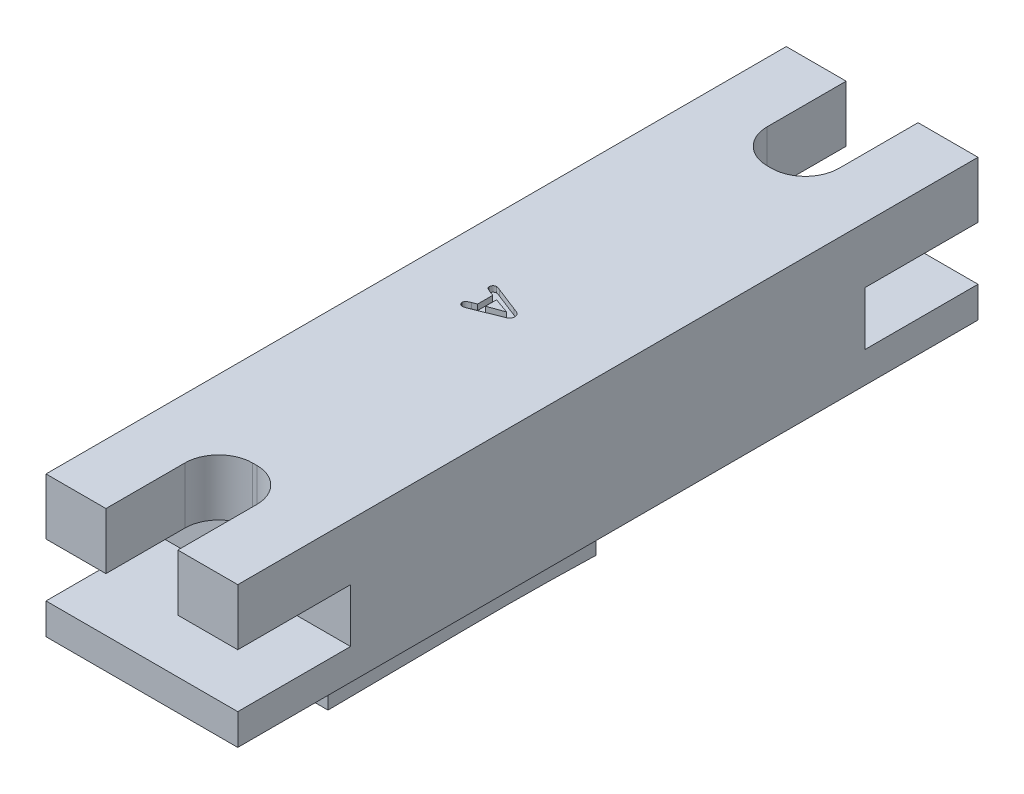
from build123d import *

# Parameters (mm, degrees)
SKETCH2_W            = 17.272
SKETCH2_H            = 66.675
BOSS_EXTRUDE1_DEPTH  = 12.7
SKETCH3_W            = 5.08
SKETCH3_H            = 6.35
SKETCH3_H_2          = 1.905
SKETCH3_H_3          = 1.27
BOSS_EXTRUDE2_DEPTH  = 12.7
CUT_EXTRUDE1_DEPTH   = 10.16
FILLET2_R            = 3.048
FILLET2_OF_MIRROR1_R = 3.048
CUT_EXTRUDE4_DEPTH   = 70.454139178
CUT_EXTRUDE5_DEPTH   = 0.508
CUT_EXTRUDE6_DEPTH   = 70.454139314


with BuildPart() as part:
    # Sketch2 → Boss-Extrude1 (new body)
    with BuildSketch(Plane(origin=(0, 0, 0), x_dir=(1, 0, 0), z_dir=(0, 1, 0))):
        with Locations((8.636, 33.3375)):
            Rectangle(SKETCH2_W, SKETCH2_H)
    extrude(amount=BOSS_EXTRUDE1_DEPTH)

    # Sketch3 → Boss-Extrude2 (add)
    with BuildSketch(Plane.XZ):
        with Locations((5.08, -29.21)):
            Rectangle(SKETCH3_W, SKETCH3_H)
        with Locations((5.08, -20.955)):
            Rectangle(SKETCH3_W, SKETCH3_H)
        with Locations((5.08, -25.0825)):
            Rectangle(SKETCH3_W, SKETCH3_H_2)
        with Locations((5.08, -33.3375)):
            Rectangle(SKETCH3_W, SKETCH3_H_2)
        with Locations((5.08, -37.465)):
            Rectangle(SKETCH3_W, SKETCH3_H)
        with Locations((5.08, -41.275)):
            Rectangle(SKETCH3_W, SKETCH3_H_3)
    extrude(amount=BOSS_EXTRUDE2_DEPTH)

    # Sketch4 → Cut-Extrude1 (cut)
    with BuildSketch(Plane.XY):
        Polygon((0, 7.62), (5.3975, 7.62), (5.3975, 12.7), (11.8745, 12.7), (11.8745, 7.62), (17.272, 7.62), (17.272, 2.794), (0, 2.794), align=None)
    cut_extrude1 = extrude(amount=-CUT_EXTRUDE1_DEPTH, mode=Mode.SUBTRACT)

    # Fillet2
    fillet2_edges = [part.edges().sort_by_distance(p)[0] for p in [
        (5.3975, 10.16, -10.16),
        (11.8745, 10.16, -10.16),
    ]]
    fillet(fillet2_edges, radius=FILLET2_R)

    # Mirror1: Cut-Extrude1 across plane
    add(cut_extrude1.mirror(Plane.XY.offset(-33.3375)), mode=Mode.SUBTRACT)

    # Fillet2 of Mirror1
    fillet2_of_mirror1_edges = [part.edges().sort_by_distance(p)[0] for p in [
        (5.3975, 10.16, -56.515),
        (11.8745, 10.16, -56.515),
    ]]
    fillet(fillet2_of_mirror1_edges, radius=FILLET2_OF_MIRROR1_R)

    # Sketch5 → Cut-Extrude4 (cut, through all)
    with BuildSketch(Plane.ZY.offset(-2.54)):
        with BuildLine():
            Line((-66.675, -12.7), (0, -12.7))
            ThreePointArc((0, -12.7), (-33.3375, -10.668), (-66.675, -12.7))
        make_face()
    extrude(amount=-CUT_EXTRUDE4_DEPTH, mode=Mode.SUBTRACT)

    # Sketch6 → Cut-Extrude5 (cut)
    with BuildSketch(Plane(origin=(0, 12.7, 0), x_dir=(1, 0, 0), z_dir=(0, 1, 0))):
        with BuildLine():
            Line((5.776894531, 32.530175781), (6.185, 32.690136719))
            Line((6.185, 32.690136719), (6.185, 34.051171875))
            Line((6.185, 34.051171875), (5.768007812, 34.211132812))
            add(Edge.make_bspline(
                [(5.768007812, 34.211132812), (5.730494518, 34.225820978), (5.661738716, 34.25274201), (5.569524922, 34.294468396), (5.496856289, 34.332290336), (5.44041907, 34.367362499), (5.398808713, 34.408271263), (5.372150366, 34.459568119), (5.356449781, 34.520790431), (5.354690345, 34.564901212), (5.35375, 34.588476562)],
                knots=[0, 0, 0, 0, 1.589179946, 2.912709847, 3.990397165, 4.820646782, 5.526248733, 6.26234321, 7.071295771, 8, 8, 8, 8], degree=3))
            add(Edge.make_bspline(
                [(5.35375, 34.588476562), (5.354923711, 34.609350692), (5.35723832, 34.650515396), (5.376105038, 34.709983847), (5.405904793, 34.765474392), (5.446909477, 34.815335315), (5.494806824, 34.85769508), (5.547709989, 34.88945387), (5.604426015, 34.909062179), (5.643671152, 34.911349233), (5.663417969, 34.9125)],
                knots=[0, 0, 0, 0, 1.012851797, 1.997388367, 3.003373292, 4.058581268, 5.118255936, 6.09654221, 7.042244815, 8, 8, 8, 8], degree=3))
            add(Edge.make_bspline(
                [(5.663417969, 34.9125), (5.687013914, 34.911555345), (5.735537805, 34.90961271), (5.796155547, 34.892709958), (5.849374825, 34.875661052), (5.897051464, 34.858225338), (5.952411749, 34.838064341), (5.991361751, 34.822388839), (6.012050781, 34.8140625)],
                knots=[0, 0, 0, 0, 1.162954171, 2.391557502, 3.08930458, 3.926034863, 4.898374222, 6, 6, 6, 6], degree=3))
            Line((6.012050781, 34.8140625), (8.209804687, 33.957519531))
            add(Edge.make_bspline(
                [(8.209804687, 33.957519531), (8.226428771, 33.951113113), (8.261020453, 33.937782526), (8.315677882, 33.917334175), (8.374470369, 33.893962658), (8.436973219, 33.870121703), (8.499246191, 33.845277035), (8.557274142, 33.8177815), (8.609899907, 33.789999082), (8.657389954, 33.761144082), (8.699684296, 33.729310109), (8.738099697, 33.693741829), (8.770436623, 33.651946673), (8.800403384, 33.607060747), (8.824677671, 33.556645473), (8.841672776, 33.500421669), (8.85196969, 33.4385942), (8.85314235, 33.395419307), (8.85375, 33.373046875)],
                knots=[0, 0, 0, 0, 0.906379869, 1.886010981, 2.968854674, 4.124928175, 5.289572165, 6.378603586, 7.389892814, 8.31643566, 9.202117826, 10.079567999, 10.970318812, 11.883493671, 12.821997982, 13.804710887, 14.862441745, 16, 16, 16, 16], degree=3))
            add(Edge.make_bspline(
                [(8.85375, 33.373046875), (8.853143023, 33.350446171), (8.85197131, 33.306817548), (8.841657146, 33.244325061), (8.824718356, 33.187386785), (8.800407201, 33.136711098), (8.771490665, 33.091190553), (8.738270432, 33.050541152), (8.70140971, 33.013950972), (8.646096874, 32.972422303), (8.570937447, 32.928580779), (8.490808779, 32.890179852), (8.419869551, 32.862917705), (8.358755001, 32.838536673), (8.289151734, 32.812137701), (8.23988638, 32.793577043), (8.21390625, 32.783789062)],
                knots=[0, 0, 0, 0, 1.00520059, 1.940449142, 2.809766755, 3.639873923, 4.433178694, 5.204465738, 5.971742598, 6.738416121, 8.27578173, 9.83615209, 10.687299641, 11.65709467, 12.764466697, 14, 14, 14, 14], degree=3))
            Line((8.21390625, 32.783789062), (6.030507812, 31.908789062))
            add(Edge.make_bspline(
                [(6.030507812, 31.908789062), (6.010470664, 31.900780275), (5.971885996, 31.885358101), (5.916134993, 31.863706725), (5.864078369, 31.847042494), (5.816554299, 31.832321275), (5.773278478, 31.820653382), (5.734277438, 31.812380787), (5.699571652, 31.807024394), (5.67778988, 31.806498136), (5.667519531, 31.80625)],
                knots=[0, 0, 0, 0, 1.366342978, 2.631107437, 3.785388659, 4.825962469, 5.781334485, 6.621722106, 7.350126631, 8, 8, 8, 8], degree=3))
            add(Edge.make_bspline(
                [(5.667519531, 31.80625), (5.648226041, 31.807426445), (5.609433355, 31.809791878), (5.553209022, 31.829532937), (5.499526082, 31.860395105), (5.450055079, 31.902282304), (5.40703675, 31.952295628), (5.376604178, 32.009857625), (5.357023182, 32.071819825), (5.354854098, 32.115086145), (5.35375, 32.137109375)],
                knots=[0, 0, 0, 0, 0.918866393, 1.847529694, 2.812122199, 3.862154056, 4.927509125, 5.939679135, 6.951264583, 8, 8, 8, 8], degree=3))
            add(Edge.make_bspline(
                [(5.35375, 32.137109375), (5.354800528, 32.162129105), (5.356770672, 32.209050699), (5.378297511, 32.273936), (5.412022157, 32.327652709), (5.44901113, 32.36544648), (5.485613066, 32.391416915), (5.519260812, 32.411831411), (5.559015285, 32.432959548), (5.618650091, 32.460955232), (5.691860724, 32.493644584), (5.749980868, 32.518613458), (5.776894531, 32.530175781)],
                knots=[0, 0, 0, 0, 1.202442774, 2.255041588, 3.251816137, 4.238368336, 4.781120761, 5.412282472, 6.134737701, 6.950402798, 8.587824681, 10, 10, 10, 10], degree=3))
        make_face()
        Polygon((6.71, 33.8734375), (6.71, 32.87265625), (8.11, 33.377832031), align=None, mode=Mode.SUBTRACT)
    extrude(amount=-CUT_EXTRUDE5_DEPTH, mode=Mode.SUBTRACT)

    # Sketch7 → Cut-Extrude6 (cut, through all)
    with BuildSketch(Plane.ZY.offset(-2.54)):
        with BuildLine():
            Line((-17.78, -11.109241116), (-17.78, -10.805360899))
            Line((-17.78, -10.805360899), (-30.099808499, -10.687095595))
            ThreePointArc((-30.099808499, -10.687095595), (-23.93753417, -10.829000448), (-17.78, -11.109241116))
        make_face()
    extrude(amount=-CUT_EXTRUDE6_DEPTH, mode=Mode.SUBTRACT)


solid = part.part
